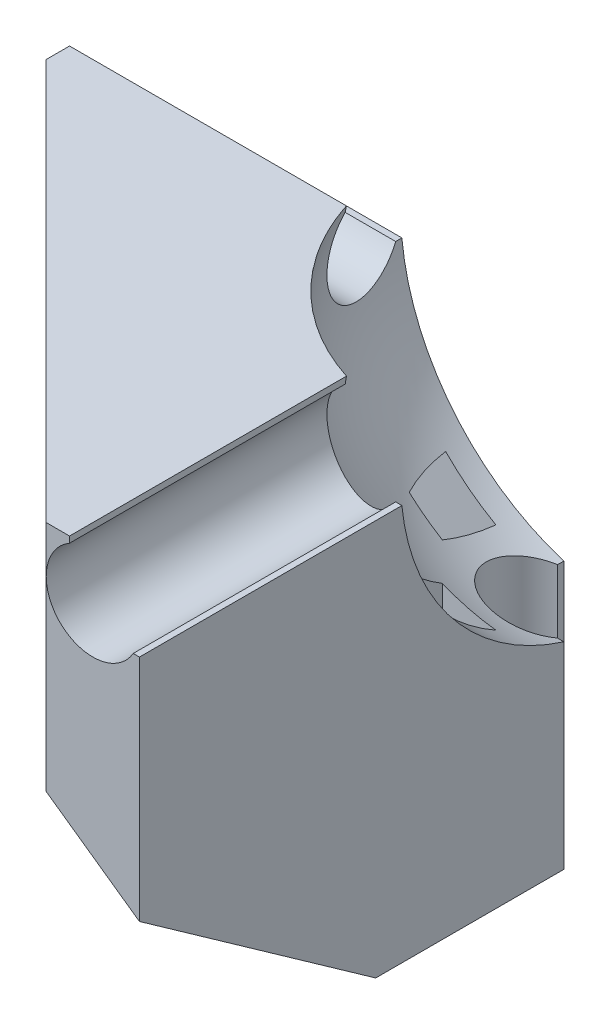
from build123d import *

# Parameters (mm, degrees)
EXTRUDE_1_DEPTH     = 20
CHAMFER_1_SIZE      = 10
CUT_EXTRUDE_2_REACH = 38.056
SKETCH_4_W          = 2.3
SKETCH_4_H          = 5.3
CUT_EXTRUDE_3_DEPTH = 11


with BuildPart() as part:
    # 草圖1 → 填料-伸長1 (new body)
    with BuildSketch(Plane(origin=(0, 0, 0), x_dir=(1, 0, 0), z_dir=(0, 1, 0))):
        with BuildLine():
            Line((0, -4), (0, -21.213203436))
            Line((0, -21.213203436), (-4, -21.213203436))
            Line((-4, -21.213203436), (-21.213203436, -4))
            Line((-21.213203436, -4), (-21.213203436, 0))
            Line((-21.213203436, 0), (-4, 0))
            Line((-4, 0), (-3, 0))
            Line((-3, 0), (-3, -0.267949192))
            ThreePointArc((-3, -0.267949192), (-3.414213562, -3.414213562), (-0.267949192, -3))
            Line((-0.267949192, -3), (0, -3))
            Line((0, -3), (0, -4))
        make_face()
    extrude(amount=EXTRUDE_1_DEPTH)

    # 導角1
    chamfer_1_edges = [part.edges().sort_by_distance(p)[0] for p in [
        (-12.606601718, 0, 12.606601718),
    ]]
    chamfer(chamfer_1_edges, length=CHAMFER_1_SIZE)

    # 草圖3 → 除料-伸長2 (cut, up to next)
    with BuildSketch(Plane.ZY.offset(21.213203436), mode=Mode.PRIVATE) as cut_extrude_2_sk1:
        with BuildLine():
            Line((3, 19.732050808), (3, 20))
            Line((3, 20), (0, 20))
            Line((0, 20), (0, 17))
            Line((0, 17), (0.267949192, 17))
            ThreePointArc((0.267949192, 17), (3.414213562, 16.585786438), (3, 19.732050808))
        make_face()
    cut_extrude_2_tool1 = extrude(cut_extrude_2_sk1.sketch, amount=-CUT_EXTRUDE_2_REACH, mode=Mode.PRIVATE) & part.part
    cut_extrude_2 = cut_extrude_2_tool1.solids().sort_by_distance((-21.213203, 18.105499, 1.894501))[0]
    add(cut_extrude_2, mode=Mode.SUBTRACT)

    # 鏡射1: 除料-伸長2 across plane
    add(cut_extrude_2.mirror(Plane(origin=(0, 0, 0), x_dir=(-0.7071067811865478, 0, 0.7071067811865472), z_dir=(0.7071067811865475, 0, 0.7071067811865477))), mode=Mode.SUBTRACT)

    # 草圖4 → 除料-伸長3 (cut)
    with BuildSketch(Plane.XZ):
        with Locations((-2.15, 7.563203436)):
            Rectangle(SKETCH_4_W, SKETCH_4_H)
    cut_extrude_3 = extrude(amount=-CUT_EXTRUDE_3_DEPTH, mode=Mode.SUBTRACT)

    # 鏡射2: 除料-伸長3 across plane
    add(cut_extrude_3.mirror(Plane(origin=(0, 0, 0), x_dir=(-0.7071067811865478, 0, 0.7071067811865472), z_dir=(0.7071067811865475, 0, 0.7071067811865477))), mode=Mode.SUBTRACT)

    # 草圖5 → 除料-旋轉1 (revolve, cut)
    with BuildSketch(Plane(origin=(0, 18, 0), x_dir=(1, 0, 0), z_dir=(0, 1, 0))):
        with BuildLine():
            Line((10, 0), (-10, 0))
            ThreePointArc((-10, 0), (0, -10), (10, 0))
        make_face()
    revolve(axis=Axis((10, 18, 0), (-1, 0, 0)), mode=Mode.SUBTRACT)


solid = part.part
